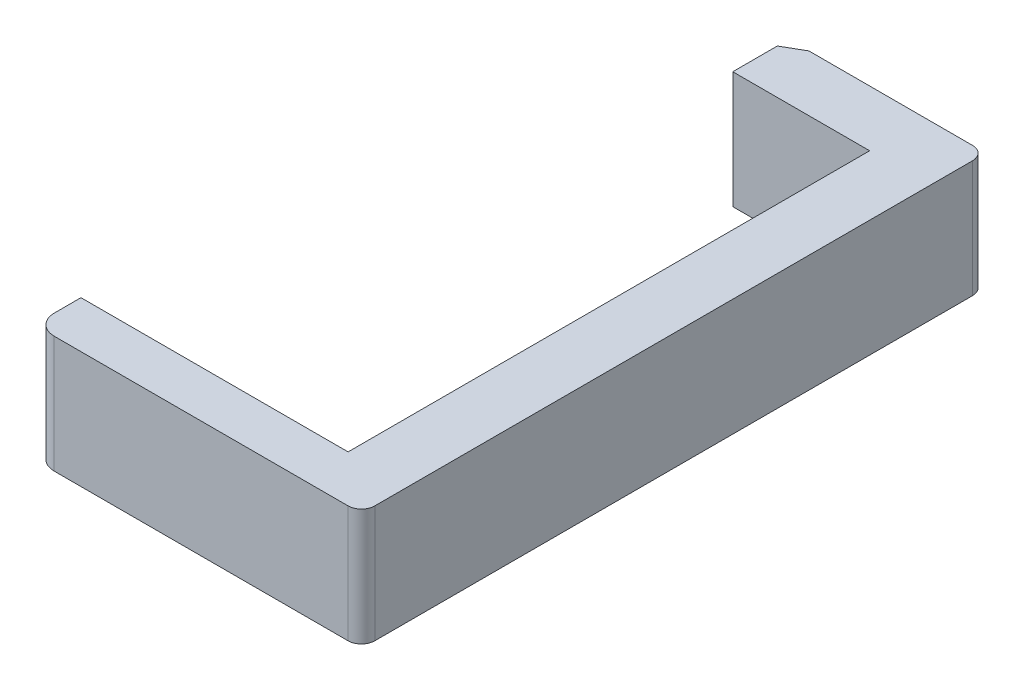
from build123d import *

# Parameters (mm, degrees)
BOSS_EXTRUDE1_DEPTH = 8.75
FILLET1_R           = 2
CHAMFER1_SIZE       = 3
CHAMFER1_SIZE2      = 1.732050808
FILLET2_R           = 3


with BuildPart() as part:
    # Sketch1 → Boss-Extrude1 (new, symmetric)
    with BuildSketch(Plane(origin=(0, 0, 0), x_dir=(1, 0, 0), z_dir=(0, 1, 0))):
        Polygon((0, 39.05), (0, -39.05), (-40, -39.05), (-40, -46.05), (9, -46.05), (9, 47.45), (-20.5, 47.45), (-20.5, 39.05), align=None)
    extrude(amount=BOSS_EXTRUDE1_DEPTH, both=True)

    # Fillet1
    fillet1_edges = [part.edges().sort_by_distance(p)[0] for p in [
        (9, 0, -47.45),
        (9, 0, 46.05),
    ]]
    fillet(fillet1_edges, radius=FILLET1_R)

    # Chamfer1
    chamfer1_edges = [part.edges().sort_by_distance(p)[0] for p in [
        (-20.5, 0, -47.45),
    ]]
    chamfer1_side = [part.faces().sort_by_distance(p)[0] for p in [
        (-6.75, 0, -47.45),
    ]]
    chamfer(chamfer1_edges, length=CHAMFER1_SIZE, length2=CHAMFER1_SIZE2, reference=chamfer1_side[0])

    # Fillet2
    fillet2_edges = [part.edges().sort_by_distance(p)[0] for p in [
        (-40, 0, 46.05),
    ]]
    fillet(fillet2_edges, radius=FILLET2_R)


solid = part.part
